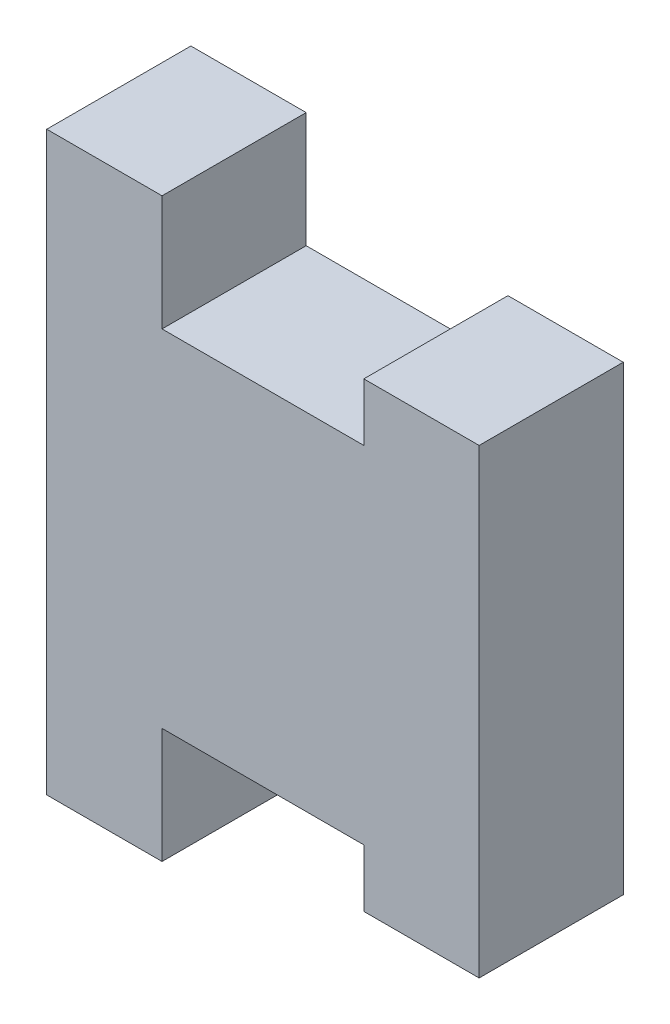
from build123d import *

# Parameters (mm, degrees)
BOSS_EXTRUDE1_DEPTH = 0.125


with BuildPart() as part:
    # frame_outline → Boss-Extrude1 (new, symmetric)
    with BuildSketch(Plane.XY):
        Polygon((0, 0), (0, 1), (0.2, 1), (0.2, 0.8), (0.55, 0.8), (0.55, 0.9), (0.75, 0.9), (0.75, 0.1), (0.55, 0.1), (0.55, 0.2), (0.2, 0.2), (0.2, 0), align=None)
    extrude(amount=BOSS_EXTRUDE1_DEPTH, both=True)


solid = part.part
